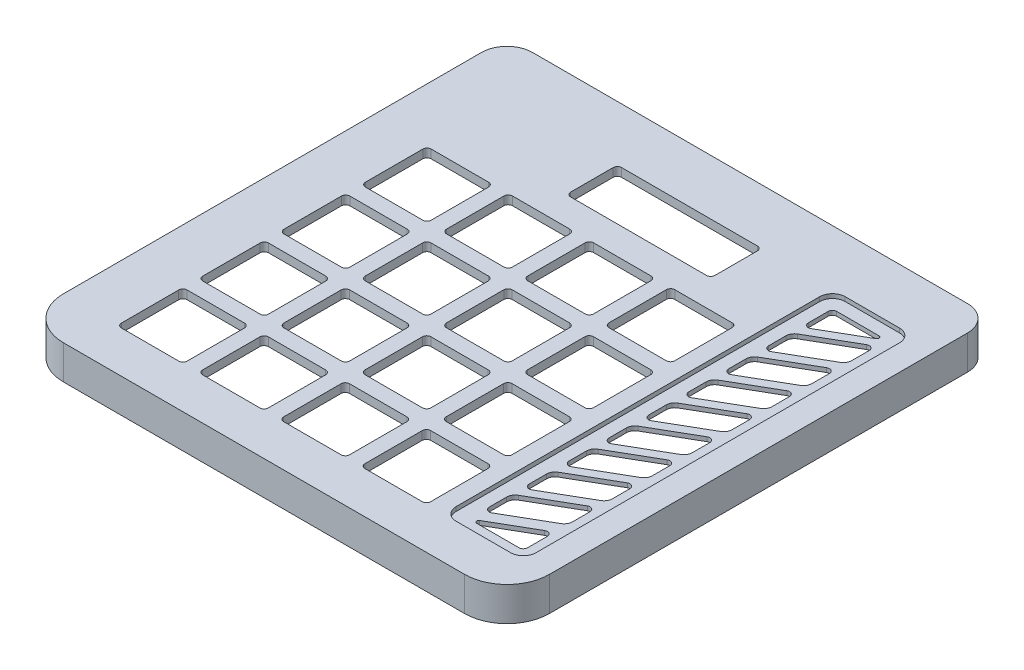
from build123d import *

# Parameters (mm, degrees)
BOSS_EXTRU_1_DEPTH      = 6
BOSS_EXTRU_2_DEPTH      = 2
ENL_V_MAT_EXTRU_1_DEPTH = 33
ENL_V_MAT_EXTRU_2_DEPTH = 2
ENL_V_MAT_EXTRU_3_DEPTH = 1
ENL_V_MAT_EXTRU_5_DEPTH = 2


with BuildPart() as part:
    # Esquisse2 → Boss.-Extru.1 (new body)
    with BuildSketch(Plane(origin=(0, 0, 0), x_dir=(1, 0, 0), z_dir=(0, 1, 0))):
        with BuildLine():
            Line((8, -2), (102.5, -2))
            ThreePointArc((102.5, -2), (109.571067812, 0.928932188), (112.5, 8))
            Line((112.5, 8), (112.5, 106.5))
            ThreePointArc((112.5, 106.5), (110.742640687, 110.742640687), (106.5, 112.5))
            Line((106.5, 112.5), (4, 112.5))
            ThreePointArc((4, 112.5), (-0.242640687, 110.742640687), (-2, 106.5))
            Line((-2, 106.5), (-2, 8))
            ThreePointArc((-2, 8), (0.928932188, 0.928932188), (8, -2))
        make_face()
        with BuildLine():
            Line((8, 0), (102.5, 0))
            ThreePointArc((102.5, 0), (108.156854249, 2.343145751), (110.5, 8))
            Line((110.5, 8), (110.5, 106.5))
            ThreePointArc((110.5, 106.5), (109.328427125, 109.328427125), (106.5, 110.5))
            Line((106.5, 110.5), (4, 110.5))
            ThreePointArc((4, 110.5), (1.171572875, 109.328427125), (0, 106.5))
            Line((0, 106.5), (0, 8))
            ThreePointArc((0, 8), (2.343145751, 2.343145751), (8, 0))
        make_face(mode=Mode.SUBTRACT)
    extrude(amount=BOSS_EXTRU_1_DEPTH)

    # Esquisse3 → Boss.-Extru.2 (add)
    with BuildSketch(Plane(origin=(0, 6, 0), x_dir=(1, 0, 0), z_dir=(0, 1, 0))):
        with BuildLine():
            Line((4, 112.5), (106.5, 112.5))
            ThreePointArc((106.5, 112.5), (110.742640687, 110.742640687), (112.5, 106.5))
            Line((112.5, 106.5), (112.5, 8))
            ThreePointArc((112.5, 8), (109.571067812, 0.928932188), (102.5, -2))
            Line((102.5, -2), (8, -2))
            ThreePointArc((8, -2), (0.928932188, 0.928932188), (-2, 8))
            Line((-2, 8), (-2, 106.5))
            ThreePointArc((-2, 106.5), (-0.242640687, 110.742640687), (4, 112.5))
        make_face()
    extrude(amount=BOSS_EXTRU_2_DEPTH)

    # Esquisse5 → Enlèv. mat.-Extru.1 (cut)
    with BuildSketch(Plane(origin=(0, 8, 0), x_dir=(1, 0, 0), z_dir=(0, 1, 0))):
        with BuildLine():
            ThreePointArc((37, 88.5), (37.292893219, 87.792893219), (38, 87.5))
            Line((38, 87.5), (70, 87.5))
            ThreePointArc((70, 87.5), (70.707106781, 87.792893219), (71, 88.5))
            Line((71, 88.5), (71, 98.5))
            ThreePointArc((71, 98.5), (70.707106781, 99.207106781), (70, 99.5))
            Line((70, 99.5), (38, 99.5))
            ThreePointArc((38, 99.5), (37.292893219, 99.207106781), (37, 98.5))
            Line((37, 98.5), (37, 88.5))
        make_face()
        with BuildLine():
            Line((25.3, 80.848985119), (11.8, 80.848985119))
            ThreePointArc((11.8, 80.848985119), (11.092893219, 80.5560919), (10.8, 79.848985119))
            Line((10.8, 79.848985119), (10.8, 66.348985119))
            ThreePointArc((10.8, 66.348985119), (11.092893219, 65.641878337), (11.8, 65.348985119))
            Line((11.8, 65.348985119), (25.3, 65.348985119))
            ThreePointArc((25.3, 65.348985119), (26.007106781, 65.641878337), (26.3, 66.348985119))
            Line((26.3, 66.348985119), (26.3, 79.848985119))
            ThreePointArc((26.3, 79.848985119), (26.007106781, 80.5560919), (25.3, 80.848985119))
        make_face()
        with BuildLine():
            ThreePointArc((30.9262, 80.848985119), (30.219093219, 80.5560919), (29.9262, 79.848985119))
            Line((29.9262, 79.848985119), (29.9262, 66.348985119))
            ThreePointArc((29.9262, 66.348985119), (30.219093219, 65.641878337), (30.9262, 65.348985119))
            Line((30.9262, 65.348985119), (44.4262, 65.348985119))
            ThreePointArc((44.4262, 65.348985119), (45.133306781, 65.641878337), (45.4262, 66.348985119))
            Line((45.4262, 66.348985119), (45.4262, 79.848985119))
            ThreePointArc((45.4262, 79.848985119), (45.133306781, 80.5560919), (44.4262, 80.848985119))
            Line((44.4262, 80.848985119), (30.9262, 80.848985119))
        make_face()
        with BuildLine():
            ThreePointArc((50.0524, 80.848985119), (49.345293219, 80.5560919), (49.0524, 79.848985119))
            Line((49.0524, 79.848985119), (49.0524, 66.348985119))
            ThreePointArc((49.0524, 66.348985119), (49.345293219, 65.641878337), (50.0524, 65.348985119))
            Line((50.0524, 65.348985119), (63.5524, 65.348985119))
            ThreePointArc((63.5524, 65.348985119), (64.259506781, 65.641878337), (64.5524, 66.348985119))
            Line((64.5524, 66.348985119), (64.5524, 79.848985119))
            ThreePointArc((64.5524, 79.848985119), (64.259506781, 80.5560919), (63.5524, 80.848985119))
            Line((63.5524, 80.848985119), (50.0524, 80.848985119))
        make_face()
        with BuildLine():
            ThreePointArc((69.1786, 80.848985119), (68.471493219, 80.5560919), (68.1786, 79.848985119))
            Line((68.1786, 79.848985119), (68.1786, 66.348985119))
            ThreePointArc((68.1786, 66.348985119), (68.471493219, 65.641878337), (69.1786, 65.348985119))
            Line((69.1786, 65.348985119), (82.6786, 65.348985119))
            ThreePointArc((82.6786, 65.348985119), (83.385706781, 65.641878337), (83.6786, 66.348985119))
            Line((83.6786, 66.348985119), (83.6786, 79.848985119))
            ThreePointArc((83.6786, 79.848985119), (83.385706781, 80.5560919), (82.6786, 80.848985119))
            Line((82.6786, 80.848985119), (69.1786, 80.848985119))
        make_face()
        with BuildLine():
            ThreePointArc((30.9262, 61.681485119), (30.219093219, 61.3885919), (29.9262, 60.681485119))
            Line((29.9262, 60.681485119), (29.9262, 47.181485119))
            ThreePointArc((29.9262, 47.181485119), (30.219093219, 46.474378337), (30.9262, 46.181485119))
            Line((30.9262, 46.181485119), (44.4262, 46.181485119))
            ThreePointArc((44.4262, 46.181485119), (45.133306781, 46.474378337), (45.4262, 47.181485119))
            Line((45.4262, 47.181485119), (45.4262, 60.681485119))
            ThreePointArc((45.4262, 60.681485119), (45.133306781, 61.3885919), (44.4262, 61.681485119))
            Line((44.4262, 61.681485119), (30.9262, 61.681485119))
        make_face()
        with BuildLine():
            ThreePointArc((50.0524, 61.681485119), (49.345293219, 61.3885919), (49.0524, 60.681485119))
            Line((49.0524, 60.681485119), (49.0524, 47.181485119))
            ThreePointArc((49.0524, 47.181485119), (49.345293219, 46.474378337), (50.0524, 46.181485119))
            Line((50.0524, 46.181485119), (63.5524, 46.181485119))
            ThreePointArc((63.5524, 46.181485119), (64.259506781, 46.474378337), (64.5524, 47.181485119))
            Line((64.5524, 47.181485119), (64.5524, 60.681485119))
            ThreePointArc((64.5524, 60.681485119), (64.259506781, 61.3885919), (63.5524, 61.681485119))
            Line((63.5524, 61.681485119), (50.0524, 61.681485119))
        make_face()
        with BuildLine():
            ThreePointArc((69.1786, 61.681485119), (68.471493219, 61.3885919), (68.1786, 60.681485119))
            Line((68.1786, 60.681485119), (68.1786, 47.181485119))
            ThreePointArc((68.1786, 47.181485119), (68.471493219, 46.474378337), (69.1786, 46.181485119))
            Line((69.1786, 46.181485119), (82.6786, 46.181485119))
            ThreePointArc((82.6786, 46.181485119), (83.385706781, 46.474378337), (83.6786, 47.181485119))
            Line((83.6786, 47.181485119), (83.6786, 60.681485119))
            ThreePointArc((83.6786, 60.681485119), (83.385706781, 61.3885919), (82.6786, 61.681485119))
            Line((82.6786, 61.681485119), (69.1786, 61.681485119))
        make_face()
        with BuildLine():
            ThreePointArc((30.9262, 42.513985119), (30.219093219, 42.2210919), (29.9262, 41.513985119))
            Line((29.9262, 41.513985119), (29.9262, 28.013985119))
            ThreePointArc((29.9262, 28.013985119), (30.219093219, 27.306878337), (30.9262, 27.013985119))
            Line((30.9262, 27.013985119), (44.4262, 27.013985119))
            ThreePointArc((44.4262, 27.013985119), (45.133306781, 27.306878337), (45.4262, 28.013985119))
            Line((45.4262, 28.013985119), (45.4262, 41.513985119))
            ThreePointArc((45.4262, 41.513985119), (45.133306781, 42.2210919), (44.4262, 42.513985119))
            Line((44.4262, 42.513985119), (30.9262, 42.513985119))
        make_face()
        with BuildLine():
            ThreePointArc((50.0524, 42.513985119), (49.345293219, 42.2210919), (49.0524, 41.513985119))
            Line((49.0524, 41.513985119), (49.0524, 28.013985119))
            ThreePointArc((49.0524, 28.013985119), (49.345293219, 27.306878337), (50.0524, 27.013985119))
            Line((50.0524, 27.013985119), (63.5524, 27.013985119))
            ThreePointArc((63.5524, 27.013985119), (64.259506781, 27.306878337), (64.5524, 28.013985119))
            Line((64.5524, 28.013985119), (64.5524, 41.513985119))
            ThreePointArc((64.5524, 41.513985119), (64.259506781, 42.2210919), (63.5524, 42.513985119))
            Line((63.5524, 42.513985119), (50.0524, 42.513985119))
        make_face()
        with BuildLine():
            ThreePointArc((69.1786, 42.513985119), (68.471493219, 42.2210919), (68.1786, 41.513985119))
            Line((68.1786, 41.513985119), (68.1786, 28.013985119))
            ThreePointArc((68.1786, 28.013985119), (68.471493219, 27.306878337), (69.1786, 27.013985119))
            Line((69.1786, 27.013985119), (82.6786, 27.013985119))
            ThreePointArc((82.6786, 27.013985119), (83.385706781, 27.306878337), (83.6786, 28.013985119))
            Line((83.6786, 28.013985119), (83.6786, 41.513985119))
            ThreePointArc((83.6786, 41.513985119), (83.385706781, 42.2210919), (82.6786, 42.513985119))
            Line((82.6786, 42.513985119), (69.1786, 42.513985119))
        make_face()
        with BuildLine():
            ThreePointArc((30.9262, 23.346485119), (30.219093219, 23.0535919), (29.9262, 22.346485119))
            Line((29.9262, 22.346485119), (29.9262, 8.846485119))
            ThreePointArc((29.9262, 8.846485119), (30.219093219, 8.139378337), (30.9262, 7.846485119))
            Line((30.9262, 7.846485119), (44.4262, 7.846485119))
            ThreePointArc((44.4262, 7.846485119), (45.133306781, 8.139378337), (45.4262, 8.846485119))
            Line((45.4262, 8.846485119), (45.4262, 22.346485119))
            ThreePointArc((45.4262, 22.346485119), (45.133306781, 23.0535919), (44.4262, 23.346485119))
            Line((44.4262, 23.346485119), (30.9262, 23.346485119))
        make_face()
        with BuildLine():
            ThreePointArc((50.0524, 23.346485119), (49.345293219, 23.0535919), (49.0524, 22.346485119))
            Line((49.0524, 22.346485119), (49.0524, 8.846485119))
            ThreePointArc((49.0524, 8.846485119), (49.345293219, 8.139378337), (50.0524, 7.846485119))
            Line((50.0524, 7.846485119), (63.5524, 7.846485119))
            ThreePointArc((63.5524, 7.846485119), (64.259506781, 8.139378337), (64.5524, 8.846485119))
            Line((64.5524, 8.846485119), (64.5524, 22.346485119))
            ThreePointArc((64.5524, 22.346485119), (64.259506781, 23.0535919), (63.5524, 23.346485119))
            Line((63.5524, 23.346485119), (50.0524, 23.346485119))
        make_face()
        with BuildLine():
            ThreePointArc((69.1786, 23.346485119), (68.471493219, 23.0535919), (68.1786, 22.346485119))
            Line((68.1786, 22.346485119), (68.1786, 8.846485119))
            ThreePointArc((68.1786, 8.846485119), (68.471493219, 8.139378337), (69.1786, 7.846485119))
            Line((69.1786, 7.846485119), (82.6786, 7.846485119))
            ThreePointArc((82.6786, 7.846485119), (83.385706781, 8.139378337), (83.6786, 8.846485119))
            Line((83.6786, 8.846485119), (83.6786, 22.346485119))
            ThreePointArc((83.6786, 22.346485119), (83.385706781, 23.0535919), (82.6786, 23.346485119))
            Line((82.6786, 23.346485119), (69.1786, 23.346485119))
        make_face()
        with BuildLine():
            ThreePointArc((11.8, 61.681485119), (11.092893219, 61.3885919), (10.8, 60.681485119))
            Line((10.8, 60.681485119), (10.8, 47.181485119))
            ThreePointArc((10.8, 47.181485119), (11.092893219, 46.474378337), (11.8, 46.181485119))
            Line((11.8, 46.181485119), (25.3, 46.181485119))
            ThreePointArc((25.3, 46.181485119), (26.007106781, 46.474378337), (26.3, 47.181485119))
            Line((26.3, 47.181485119), (26.3, 60.681485119))
            ThreePointArc((26.3, 60.681485119), (26.007106781, 61.3885919), (25.3, 61.681485119))
            Line((25.3, 61.681485119), (11.8, 61.681485119))
        make_face()
        with BuildLine():
            ThreePointArc((11.8, 42.513985119), (11.092893219, 42.2210919), (10.8, 41.513985119))
            Line((10.8, 41.513985119), (10.8, 28.013985119))
            ThreePointArc((10.8, 28.013985119), (11.092893219, 27.306878337), (11.8, 27.013985119))
            Line((11.8, 27.013985119), (25.3, 27.013985119))
            ThreePointArc((25.3, 27.013985119), (26.007106781, 27.306878337), (26.3, 28.013985119))
            Line((26.3, 28.013985119), (26.3, 41.513985119))
            ThreePointArc((26.3, 41.513985119), (26.007106781, 42.2210919), (25.3, 42.513985119))
            Line((25.3, 42.513985119), (11.8, 42.513985119))
        make_face()
        with BuildLine():
            ThreePointArc((11.8, 23.346485119), (11.092893219, 23.0535919), (10.8, 22.346485119))
            Line((10.8, 22.346485119), (10.8, 8.846485119))
            ThreePointArc((10.8, 8.846485119), (11.092893219, 8.139378337), (11.8, 7.846485119))
            Line((11.8, 7.846485119), (25.3, 7.846485119))
            ThreePointArc((25.3, 7.846485119), (26.007106781, 8.139378337), (26.3, 8.846485119))
            Line((26.3, 8.846485119), (26.3, 22.346485119))
            ThreePointArc((26.3, 22.346485119), (26.007106781, 23.0535919), (25.3, 23.346485119))
            Line((25.3, 23.346485119), (11.8, 23.346485119))
        make_face()
    extrude(amount=-ENL_V_MAT_EXTRU_1_DEPTH, mode=Mode.SUBTRACT)

    # Esquisse6 → Enlèv. mat.-Extru.2 (cut)
    with BuildSketch(Plane(origin=(0, 8, 0), x_dir=(1, 0, 0), z_dir=(0, 1, 0))):
        with BuildLine():
            Line((102, 93.233974596), (91.6786, 87.274911528))
            ThreePointArc((91.6786, 87.274911528), (90.946549192, 86.54286072), (90.6786, 85.54286072))
            Line((90.6786, 85.54286072), (90.6786, 81.429612066))
            ThreePointArc((90.6786, 81.429612066), (91.1786, 80.563586662), (92.1786, 80.563586662))
            Line((92.1786, 80.563586662), (102.5, 86.522649731))
            ThreePointArc((102.5, 86.522649731), (103.232050808, 87.254700538), (103.5, 88.254700538))
            Line((103.5, 88.254700538), (103.5, 92.367949192))
            ThreePointArc((103.5, 92.367949192), (103, 93.233974596), (102, 93.233974596))
        make_face()
        with BuildLine():
            ThreePointArc((91.6786, 96.5), (90.971493219, 96.207106781), (90.6786, 95.5))
            Line((90.6786, 95.5), (90.6786, 90.829612066))
            ThreePointArc((90.6786, 90.829612066), (91.1786, 89.963586662), (92.1786, 89.963586662))
            Line((92.1786, 89.963586662), (101.883974596, 95.566987298))
            ThreePointArc((101.883974596, 95.566987298), (102.116937509, 96.129409523), (101.633974596, 96.5))
            Line((101.633974596, 96.5), (91.6786, 96.5))
        make_face()
        with BuildLine():
            Line((92.544625404, 10.846485119), (102.5, 10.846485119))
            ThreePointArc((102.5, 10.846485119), (103.207106781, 11.139378337), (103.5, 11.846485119))
            Line((103.5, 11.846485119), (103.5, 16.516873052))
            ThreePointArc((103.5, 16.516873052), (103, 17.382898456), (102, 17.382898456))
            Line((102, 17.382898456), (92.294625404, 11.77949782))
            ThreePointArc((92.294625404, 11.77949782), (92.061662491, 11.217075596), (92.544625404, 10.846485119))
        make_face()
        with BuildLine():
            Line((90.6786, 76.14286072), (90.6786, 72.029612066))
            ThreePointArc((90.6786, 72.029612066), (91.1786, 71.163586662), (92.1786, 71.163586662))
            Line((92.1786, 71.163586662), (102.5, 77.122649731))
            ThreePointArc((102.5, 77.122649731), (103.232050808, 77.854700538), (103.5, 78.854700538))
            Line((103.5, 78.854700538), (103.5, 82.967949192))
            ThreePointArc((103.5, 82.967949192), (103, 83.833974596), (102, 83.833974596))
            Line((102, 83.833974596), (91.6786, 77.874911528))
            ThreePointArc((91.6786, 77.874911528), (90.946549192, 77.14286072), (90.6786, 76.14286072))
        make_face()
        with BuildLine():
            Line((90.6786, 66.74286072), (90.6786, 62.629612066))
            ThreePointArc((90.6786, 62.629612066), (91.1786, 61.763586662), (92.1786, 61.763586662))
            Line((92.1786, 61.763586662), (102.5, 67.722649731))
            ThreePointArc((102.5, 67.722649731), (103.232050808, 68.454700538), (103.5, 69.454700538))
            Line((103.5, 69.454700538), (103.5, 73.567949192))
            ThreePointArc((103.5, 73.567949192), (103, 74.433974596), (102, 74.433974596))
            Line((102, 74.433974596), (91.6786, 68.474911528))
            ThreePointArc((91.6786, 68.474911528), (90.946549192, 67.74286072), (90.6786, 66.74286072))
        make_face()
        with BuildLine():
            Line((90.6786, 57.34286072), (90.6786, 53.229612066))
            ThreePointArc((90.6786, 53.229612066), (91.1786, 52.363586662), (92.1786, 52.363586662))
            Line((92.1786, 52.363586662), (102.5, 58.322649731))
            ThreePointArc((102.5, 58.322649731), (103.232050808, 59.054700538), (103.5, 60.054700538))
            Line((103.5, 60.054700538), (103.5, 64.167949192))
            ThreePointArc((103.5, 64.167949192), (103, 65.033974596), (102, 65.033974596))
            Line((102, 65.033974596), (91.6786, 59.074911528))
            ThreePointArc((91.6786, 59.074911528), (90.946549192, 58.34286072), (90.6786, 57.34286072))
        make_face()
        with BuildLine():
            Line((90.6786, 47.94286072), (90.6786, 43.829612066))
            ThreePointArc((90.6786, 43.829612066), (91.1786, 42.963586662), (92.1786, 42.963586662))
            Line((92.1786, 42.963586662), (102.5, 48.922649731))
            ThreePointArc((102.5, 48.922649731), (103.232050808, 49.654700538), (103.5, 50.654700538))
            Line((103.5, 50.654700538), (103.5, 54.767949192))
            ThreePointArc((103.5, 54.767949192), (103, 55.633974596), (102, 55.633974596))
            Line((102, 55.633974596), (91.6786, 49.674911528))
            ThreePointArc((91.6786, 49.674911528), (90.946549192, 48.94286072), (90.6786, 47.94286072))
        make_face()
        with BuildLine():
            Line((90.6786, 38.54286072), (90.6786, 34.429612066))
            ThreePointArc((90.6786, 34.429612066), (91.1786, 33.563586662), (92.1786, 33.563586662))
            Line((92.1786, 33.563586662), (102.5, 39.522649731))
            ThreePointArc((102.5, 39.522649731), (103.232050808, 40.254700538), (103.5, 41.254700538))
            Line((103.5, 41.254700538), (103.5, 45.367949192))
            ThreePointArc((103.5, 45.367949192), (103, 46.233974596), (102, 46.233974596))
            Line((102, 46.233974596), (91.6786, 40.274911528))
            ThreePointArc((91.6786, 40.274911528), (90.946549192, 39.54286072), (90.6786, 38.54286072))
        make_face()
        with BuildLine():
            Line((90.6786, 29.14286072), (90.6786, 25.029612066))
            ThreePointArc((90.6786, 25.029612066), (91.1786, 24.163586662), (92.1786, 24.163586662))
            Line((92.1786, 24.163586662), (102.5, 30.122649731))
            ThreePointArc((102.5, 30.122649731), (103.232050808, 30.854700538), (103.5, 31.854700538))
            Line((103.5, 31.854700538), (103.5, 35.967949192))
            ThreePointArc((103.5, 35.967949192), (103, 36.833974596), (102, 36.833974596))
            Line((102, 36.833974596), (91.6786, 30.874911528))
            ThreePointArc((91.6786, 30.874911528), (90.946549192, 30.14286072), (90.6786, 29.14286072))
        make_face()
        with BuildLine():
            Line((90.6786, 19.74286072), (90.6786, 15.629612066))
            ThreePointArc((90.6786, 15.629612066), (91.1786, 14.763586662), (92.1786, 14.763586662))
            Line((92.1786, 14.763586662), (102.5, 20.722649731))
            ThreePointArc((102.5, 20.722649731), (103.232050808, 21.454700538), (103.5, 22.454700538))
            Line((103.5, 22.454700538), (103.5, 26.567949192))
            ThreePointArc((103.5, 26.567949192), (103, 27.433974596), (102, 27.433974596))
            Line((102, 27.433974596), (91.6786, 21.474911528))
            ThreePointArc((91.6786, 21.474911528), (90.946549192, 20.74286072), (90.6786, 19.74286072))
        make_face()
    extrude(amount=-ENL_V_MAT_EXTRU_2_DEPTH, mode=Mode.SUBTRACT)

    # Esquisse6<3> → Enlèv. mat.-Extru.3 (cut)
    with BuildSketch(Plane(origin=(0, 8, 0), x_dir=(1, 0, 0), z_dir=(0, 1, 0))):
        with BuildLine():
            Line((90.6786, 99.5), (103.5, 99.5))
            ThreePointArc((103.5, 99.5), (105.621320344, 98.621320344), (106.5, 96.5))
            Line((106.5, 96.5), (106.5, 10.846485119))
            ThreePointArc((106.5, 10.846485119), (105.621320344, 8.725164775), (103.5, 7.846485119))
            Line((103.5, 7.846485119), (90.6786, 7.846485119))
            ThreePointArc((90.6786, 7.846485119), (88.557279656, 8.725164775), (87.6786, 10.846485119))
            Line((87.6786, 10.846485119), (87.6786, 96.5))
            ThreePointArc((87.6786, 96.5), (88.557279656, 98.621320344), (90.6786, 99.5))
        make_face()
        with BuildLine():
            Line((91.6786, 87.274911528), (102, 93.233974596))
            ThreePointArc((102, 93.233974596), (103, 93.233974596), (103.5, 92.367949192))
            Line((103.5, 92.367949192), (103.5, 88.254700538))
            ThreePointArc((103.5, 88.254700538), (103.232050808, 87.254700538), (102.5, 86.522649731))
            Line((102.5, 86.522649731), (92.1786, 80.563586662))
            ThreePointArc((92.1786, 80.563586662), (91.1786, 80.563586662), (90.6786, 81.429612066))
            Line((90.6786, 81.429612066), (90.6786, 85.54286072))
            ThreePointArc((90.6786, 85.54286072), (90.946549192, 86.54286072), (91.6786, 87.274911528))
        make_face(mode=Mode.SUBTRACT)
        with BuildLine():
            Line((90.6786, 95.5), (90.6786, 90.829612066))
            ThreePointArc((90.6786, 90.829612066), (91.1786, 89.963586662), (92.1786, 89.963586662))
            Line((92.1786, 89.963586662), (101.883974596, 95.566987298))
            ThreePointArc((101.883974596, 95.566987298), (102.116937509, 96.129409523), (101.633974596, 96.5))
            Line((101.633974596, 96.5), (91.6786, 96.5))
            ThreePointArc((91.6786, 96.5), (90.971493219, 96.207106781), (90.6786, 95.5))
        make_face(mode=Mode.SUBTRACT)
        with BuildLine():
            Line((102.5, 10.846485119), (92.544625404, 10.846485119))
            ThreePointArc((92.544625404, 10.846485119), (92.061662491, 11.217075596), (92.294625404, 11.77949782))
            Line((92.294625404, 11.77949782), (102, 17.382898456))
            ThreePointArc((102, 17.382898456), (103, 17.382898456), (103.5, 16.516873052))
            Line((103.5, 16.516873052), (103.5, 11.846485119))
            ThreePointArc((103.5, 11.846485119), (103.207106781, 11.139378337), (102.5, 10.846485119))
        make_face(mode=Mode.SUBTRACT)
        with BuildLine():
            Line((90.6786, 72.029612066), (90.6786, 76.14286072))
            ThreePointArc((90.6786, 76.14286072), (90.946549192, 77.14286072), (91.6786, 77.874911528))
            Line((91.6786, 77.874911528), (102, 83.833974596))
            ThreePointArc((102, 83.833974596), (103, 83.833974596), (103.5, 82.967949192))
            Line((103.5, 82.967949192), (103.5, 78.854700538))
            ThreePointArc((103.5, 78.854700538), (103.232050808, 77.854700538), (102.5, 77.122649731))
            Line((102.5, 77.122649731), (92.1786, 71.163586662))
            ThreePointArc((92.1786, 71.163586662), (91.1786, 71.163586662), (90.6786, 72.029612066))
        make_face(mode=Mode.SUBTRACT)
        with BuildLine():
            Line((90.6786, 62.629612066), (90.6786, 66.74286072))
            ThreePointArc((90.6786, 66.74286072), (90.946549192, 67.74286072), (91.6786, 68.474911528))
            Line((91.6786, 68.474911528), (102, 74.433974596))
            ThreePointArc((102, 74.433974596), (103, 74.433974596), (103.5, 73.567949192))
            Line((103.5, 73.567949192), (103.5, 69.454700538))
            ThreePointArc((103.5, 69.454700538), (103.232050808, 68.454700538), (102.5, 67.722649731))
            Line((102.5, 67.722649731), (92.1786, 61.763586662))
            ThreePointArc((92.1786, 61.763586662), (91.1786, 61.763586662), (90.6786, 62.629612066))
        make_face(mode=Mode.SUBTRACT)
        with BuildLine():
            Line((90.6786, 53.229612066), (90.6786, 57.34286072))
            ThreePointArc((90.6786, 57.34286072), (90.946549192, 58.34286072), (91.6786, 59.074911528))
            Line((91.6786, 59.074911528), (102, 65.033974596))
            ThreePointArc((102, 65.033974596), (103, 65.033974596), (103.5, 64.167949192))
            Line((103.5, 64.167949192), (103.5, 60.054700538))
            ThreePointArc((103.5, 60.054700538), (103.232050808, 59.054700538), (102.5, 58.322649731))
            Line((102.5, 58.322649731), (92.1786, 52.363586662))
            ThreePointArc((92.1786, 52.363586662), (91.1786, 52.363586662), (90.6786, 53.229612066))
        make_face(mode=Mode.SUBTRACT)
        with BuildLine():
            Line((90.6786, 43.829612066), (90.6786, 47.94286072))
            ThreePointArc((90.6786, 47.94286072), (90.946549192, 48.94286072), (91.6786, 49.674911528))
            Line((91.6786, 49.674911528), (102, 55.633974596))
            ThreePointArc((102, 55.633974596), (103, 55.633974596), (103.5, 54.767949192))
            Line((103.5, 54.767949192), (103.5, 50.654700538))
            ThreePointArc((103.5, 50.654700538), (103.232050808, 49.654700538), (102.5, 48.922649731))
            Line((102.5, 48.922649731), (92.1786, 42.963586662))
            ThreePointArc((92.1786, 42.963586662), (91.1786, 42.963586662), (90.6786, 43.829612066))
        make_face(mode=Mode.SUBTRACT)
        with BuildLine():
            Line((90.6786, 34.429612066), (90.6786, 38.54286072))
            ThreePointArc((90.6786, 38.54286072), (90.946549192, 39.54286072), (91.6786, 40.274911528))
            Line((91.6786, 40.274911528), (102, 46.233974596))
            ThreePointArc((102, 46.233974596), (103, 46.233974596), (103.5, 45.367949192))
            Line((103.5, 45.367949192), (103.5, 41.254700538))
            ThreePointArc((103.5, 41.254700538), (103.232050808, 40.254700538), (102.5, 39.522649731))
            Line((102.5, 39.522649731), (92.1786, 33.563586662))
            ThreePointArc((92.1786, 33.563586662), (91.1786, 33.563586662), (90.6786, 34.429612066))
        make_face(mode=Mode.SUBTRACT)
        with BuildLine():
            Line((90.6786, 25.029612066), (90.6786, 29.14286072))
            ThreePointArc((90.6786, 29.14286072), (90.946549192, 30.14286072), (91.6786, 30.874911528))
            Line((91.6786, 30.874911528), (102, 36.833974596))
            ThreePointArc((102, 36.833974596), (103, 36.833974596), (103.5, 35.967949192))
            Line((103.5, 35.967949192), (103.5, 31.854700538))
            ThreePointArc((103.5, 31.854700538), (103.232050808, 30.854700538), (102.5, 30.122649731))
            Line((102.5, 30.122649731), (92.1786, 24.163586662))
            ThreePointArc((92.1786, 24.163586662), (91.1786, 24.163586662), (90.6786, 25.029612066))
        make_face(mode=Mode.SUBTRACT)
        with BuildLine():
            Line((90.6786, 15.629612066), (90.6786, 19.74286072))
            ThreePointArc((90.6786, 19.74286072), (90.946549192, 20.74286072), (91.6786, 21.474911528))
            Line((91.6786, 21.474911528), (102, 27.433974596))
            ThreePointArc((102, 27.433974596), (103, 27.433974596), (103.5, 26.567949192))
            Line((103.5, 26.567949192), (103.5, 22.454700538))
            ThreePointArc((103.5, 22.454700538), (103.232050808, 21.454700538), (102.5, 20.722649731))
            Line((102.5, 20.722649731), (92.1786, 14.763586662))
            ThreePointArc((92.1786, 14.763586662), (91.1786, 14.763586662), (90.6786, 15.629612066))
        make_face(mode=Mode.SUBTRACT)
    extrude(amount=-ENL_V_MAT_EXTRU_3_DEPTH, mode=Mode.SUBTRACT)

    # Esquisse10 → Enlèv. mat.-Extru.5 (cut)
    with BuildSketch(Plane(origin=(0, 0, -112.5), x_dir=(-1, 0, 0), z_dir=(0, 0, -1))):
        with BuildLine():
            Line((-99.75, 0), (-83.75, 0))
            Line((-83.75, 0), (-83.75, 2))
            ThreePointArc((-83.75, 2), (-84.335786438, 3.414213562), (-85.75, 4))
            Line((-85.75, 4), (-97.75, 4))
            ThreePointArc((-97.75, 4), (-99.164213562, 3.414213562), (-99.75, 2))
            Line((-99.75, 2), (-99.75, 0))
        make_face()
    extrude(amount=-ENL_V_MAT_EXTRU_5_DEPTH, mode=Mode.SUBTRACT)


solid = part.part
